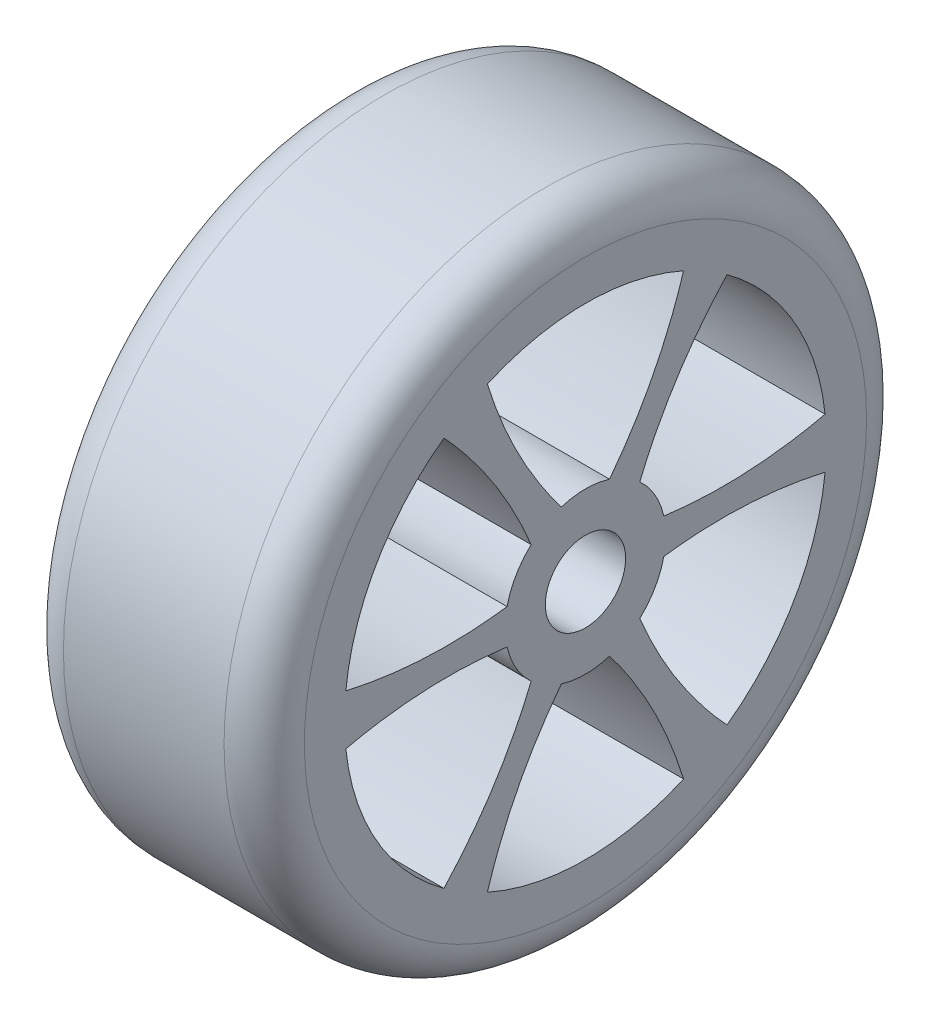
from build123d import *

# Parameters (mm, degrees)
SKETCH1_R               = 101.6
BOSS_EXTRUDE1_DEPTH     = 76.2
FILLET1_R               = 12.7
CUT_EXTRUDE1_DEPTH      = 163.639355693
CUT_EXTRUDE1_DEPTH_BACK = 163.639355693
CUT_EXTRUDE2_DEPTH      = 163.63935574
CUT_EXTRUDE2_DEPTH_BACK = 163.63935574
SKETCH5_R               = 12.7


with BuildPart() as part:
    # Sketch1 → Boss-Extrude1 (new body)
    with BuildSketch(Plane.YZ):
        with Locations(Location((0, 0, 0), (0, 0, 90))):
            Circle(SKETCH1_R)
    extrude(amount=BOSS_EXTRUDE1_DEPTH)

    # Fillet1
    fillet1_edges = [part.edges().sort_by_distance(p)[0] for p in [
        (0, 0, -101.6),
        (76.2, 0, -101.6),
    ]]
    fillet(fillet1_edges, radius=FILLET1_R)

    # Sketch2 → Cut-Extrude1 (cut, two sides: drawn at the far end of the back side and taken through both)
    with BuildSketch(Plane.YZ.offset(76.2).offset(-CUT_EXTRUDE1_DEPTH_BACK)):
        with BuildLine():
            ThreePointArc((-24.232427185, 7.612455104), (-25.4, 0), (-24.232427185, -7.612455104))
            add(Edge.make_bspline(
                [(-24.232427185, -7.612455104), (-44.761154303, -23.370868648), (-69.597655338, -31.025898399)],
                knots=[0, 0, 0, 1, 1, 1], degree=2))
            ThreePointArc((-69.597655338, -31.025898399), (-76.2, 0), (-69.597655338, 31.025898399))
            add(Edge.make_bspline(
                [(-24.232427185, 7.612455104), (-44.761154303, 23.370868648), (-69.597655338, 31.025898399)],
                knots=[0, 0, 0, 1, 1, 1], degree=2))
        make_face()
        with BuildLine():
            ThreePointArc((18.708793098, 17.179669986), (12.7, 21.997045256), (5.523634087, 24.79212509))
            add(Edge.make_bspline(
                [(5.523634087, 24.79212509), (2.140811193, 50.449731053), (7.92961148, 75.786286766)],
                knots=[0, 0, 0, 1, 1, 1], degree=2))
            ThreePointArc((7.92961148, 75.786286766), (38.1, 65.991135768), (61.668043858, 44.760388367))
            add(Edge.make_bspline(
                [(18.708793098, 17.179669986), (42.620343109, 27.078862405), (61.668043858, 44.760388367)],
                knots=[0, 0, 0, 1, 1, 1], degree=2))
        make_face()
        with BuildLine():
            ThreePointArc((24.232427185, -7.612455104), (25.4, 0), (24.232427185, 7.612455104))
            add(Edge.make_bspline(
                [(24.232427185, 7.612455104), (44.761154303, 23.370868648), (69.597655338, 31.025898399)],
                knots=[0, 0, 0, 1, 1, 1], degree=2))
            ThreePointArc((69.597655338, 31.025898399), (76.2, 0), (69.597655338, -31.025898399))
            add(Edge.make_bspline(
                [(24.232427185, -7.612455104), (44.761154303, -23.370868648), (69.597655338, -31.025898399)],
                knots=[0, 0, 0, 1, 1, 1], degree=2))
        make_face()
        with BuildLine():
            ThreePointArc((-61.668043858, -44.760388367), (-38.1, -65.991135768), (-7.92961148, -75.786286766))
            add(Edge.make_bspline(
                [(-5.523634087, -24.79212509), (-2.140811193, -50.449731053), (-7.92961148, -75.786286766)],
                knots=[0, 0, 0, 1, 1, 1], degree=2))
            ThreePointArc((-5.523634087, -24.79212509), (-12.7, -21.997045256), (-18.708793098, -17.179669986))
            add(Edge.make_bspline(
                [(-18.708793098, -17.179669986), (-42.620343109, -27.078862405), (-61.668043858, -44.760388367)],
                knots=[0, 0, 0, 1, 1, 1], degree=2))
        make_face()
        with BuildLine():
            ThreePointArc((5.523634087, -24.79212509), (12.7, -21.997045256), (18.708793098, -17.179669986))
            add(Edge.make_bspline(
                [(18.708793098, -17.179669986), (42.620343109, -27.078862405), (61.668043858, -44.760388367)],
                knots=[0, 0, 0, 1, 1, 1], degree=2))
            ThreePointArc((61.668043858, -44.760388367), (38.1, -65.991135768), (7.92961148, -75.786286766))
            add(Edge.make_bspline(
                [(5.523634087, -24.79212509), (2.140811193, -50.449731053), (7.92961148, -75.786286766)],
                knots=[0, 0, 0, 1, 1, 1], degree=2))
        make_face()
        with BuildLine():
            ThreePointArc((-7.92961148, 75.786286766), (-38.1, 65.991135768), (-61.668043858, 44.760388367))
            add(Edge.make_bspline(
                [(-18.708793098, 17.179669986), (-42.620343109, 27.078862405), (-61.668043858, 44.760388367)],
                knots=[0, 0, 0, 1, 1, 1], degree=2))
            ThreePointArc((-18.708793098, 17.179669986), (-12.7, 21.997045256), (-5.523634087, 24.79212509))
            add(Edge.make_bspline(
                [(-5.523634087, 24.79212509), (-2.140811193, 50.449731053), (-7.92961148, 75.786286766)],
                knots=[0, 0, 0, 1, 1, 1], degree=2))
        make_face()
    extrude(amount=CUT_EXTRUDE1_DEPTH + CUT_EXTRUDE1_DEPTH_BACK, mode=Mode.SUBTRACT)

    # Sketch5 → Cut-Extrude2 (cut, two sides: drawn at the far end of the back side and taken through both)
    with BuildSketch(Plane.YZ.offset(76.2).offset(-CUT_EXTRUDE2_DEPTH_BACK)):
        with Locations(Location((0, 0, 0), (0, 0, 270))):
            Circle(SKETCH5_R)
    extrude(amount=CUT_EXTRUDE2_DEPTH + CUT_EXTRUDE2_DEPTH_BACK, mode=Mode.SUBTRACT)


solid = part.part
